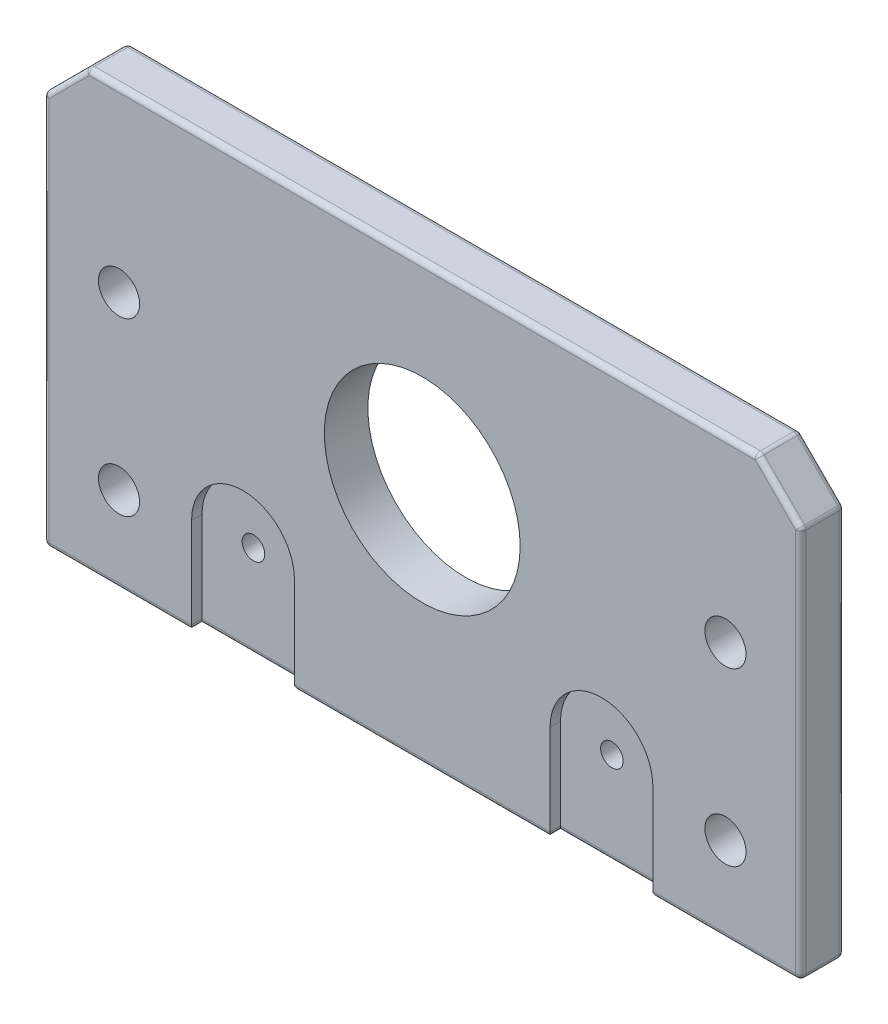
from build123d import *

# Parameters (mm, degrees)
SKETCH2_W                   = 110.49
SKETCH2_H                   = 6.35
BOSS_EXTRUDE1_DEPTH         = 63.5
SKETCH3_R                   = 14.2875
CUT_EXTRUDE1_DEPTH          = 85.407242136
CHAMFER1_SIZE               = 6.35
CUT_EXTRUDE2_DEPTH          = 1.524
TAP_DRILL_FOR_M4X0_7_TAP1_D = 3.3
TAP_DRILL_FOR_M7X1_0_TAP1_D = 6
FILLET2_R                   = 0.762


with BuildPart() as part:
    # Sketch2 → Boss-Extrude1 (new body)
    with BuildSketch(Plane(origin=(0, 0, 0), x_dir=(1, 0, 0), z_dir=(0, 1, 0))):
        Rectangle(SKETCH2_W, SKETCH2_H)
    extrude(amount=-BOSS_EXTRUDE1_DEPTH)

    # Sketch3 → Cut-Extrude1 (cut, through all)
    with BuildSketch(Plane.XY.offset(3.175)):
        with Locations((0, -28.8150046)):
            Circle(SKETCH3_R)
    extrude(amount=-CUT_EXTRUDE1_DEPTH, mode=Mode.SUBTRACT)

    # Chamfer1
    chamfer1_edges = [part.edges().sort_by_distance(p)[0] for p in [
        (55.245, 0, 0),
        (-55.245, 0, 0),
    ]]
    chamfer(chamfer1_edges, length=CHAMFER1_SIZE)

    # Sketch12 → Cut-Extrude2 (cut)
    with BuildSketch(Plane.XY.offset(3.175)):
        with BuildLine():
            Line((-33.655, -49.5), (-33.655, -63.5))
            Line((-33.655, -63.5), (-18.655, -63.5))
            Line((-18.655, -63.5), (-18.655, -49.5))
            ThreePointArc((-18.655, -49.5), (-26.155, -42), (-33.655, -49.5))
        make_face()
    cut_extrude2 = extrude(amount=-CUT_EXTRUDE2_DEPTH, mode=Mode.SUBTRACT)

    # Mirror1: Cut-Extrude2 across plane
    add(cut_extrude2.mirror(Plane(origin=(0, 0, 0), x_dir=(0, 0, 1), z_dir=(1, 0, 0))), mode=Mode.SUBTRACT)

    # Tap Drill for M4x0.7 Tap1 (through all)
    with Locations(Plane.XY.offset(3.175)):
        with Locations((-26.155, -50), (26.155, -50)):
            Hole(TAP_DRILL_FOR_M4X0_7_TAP1_D / 2)

    # Tap Drill for M7x1.0 Tap1 (through all)
    with Locations(Plane(origin=(0, 0, -3.175), x_dir=(-1, 0, 0), z_dir=(0, 0, -1))):
        with Locations((44.245, -26), (44.245, -51), (-44.245, -51), (-44.245, -26)):
            Hole(TAP_DRILL_FOR_M7X1_0_TAP1_D / 2)

    # Fillet2
    fillet2_edges = [part.edges().sort_by_distance(p)[0] for p in [
        (55.245, -63.5, 0),
        (0, -63.5, -3.175),
        (0, 0, 3.175),
        (0, 0, -3.175),
        (48.895, 0, 0),
        (-48.895, 0, 0),
        (52.07, -3.175, 3.175),
        (-52.07, -3.175, 3.175),
        (-55.245, -6.35, 0),
        (52.07, -3.175, -3.175),
        (-52.07, -3.175, -3.175),
        (55.245, -6.35, 0),
        (0, -63.5, 3.175),
        (-26.155, -63.5, 1.651),
        (-18.655, -63.5, 2.413),
        (-33.655, -63.5, 2.413),
        (44.45, -63.5, 3.175),
        (-55.245, -63.5, 0),
        (33.655, -63.5, 2.413),
        (18.655, -63.5, 2.413),
        (26.155, -63.5, 1.651),
        (-55.245, -34.925, -3.175),
        (55.245, -34.925, -3.175),
        (55.245, -34.925, 3.175),
        (-55.245, -34.925, 3.175),
        (-44.45, -63.5, 3.175),
    ]]
    fillet(fillet2_edges, radius=FILLET2_R)


solid = part.part
